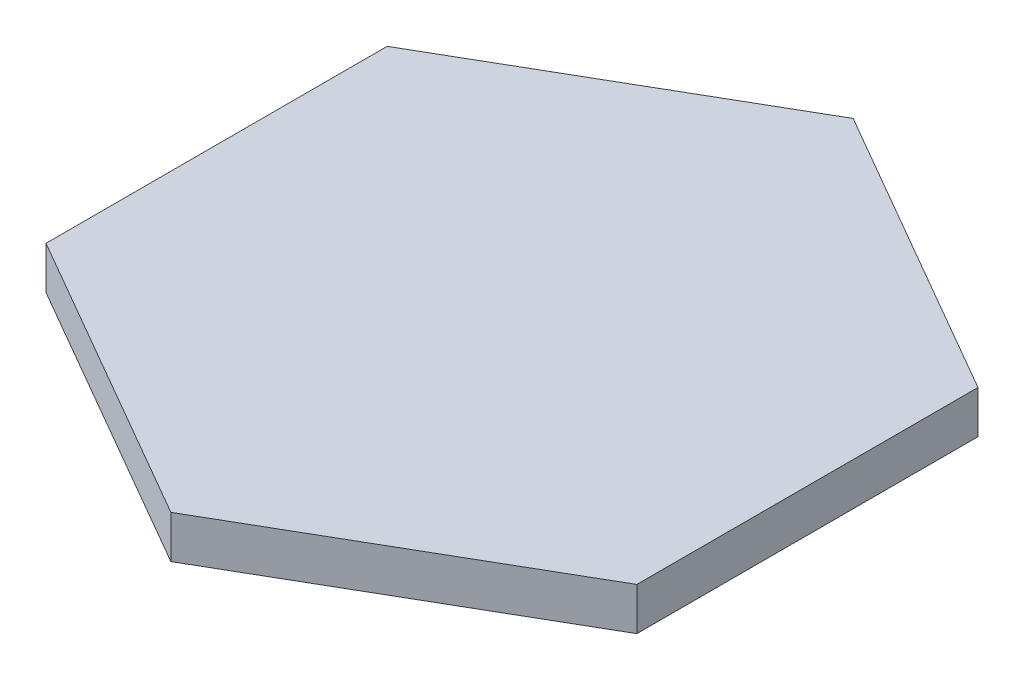
from build123d import *

# Parameters (mm, degrees)
BOSS_EXTRUDE1_DEPTH = 6.35


with BuildPart() as part:
    # Sketch1 → Boss-Extrude1 (new body)
    with BuildSketch(Plane(origin=(0, 0, 0), x_dir=(1, 0, 0), z_dir=(0, 1, 0))):
        Polygon((43.994090512, 25.4), (0, 50.8), (-43.994090512, 25.4), (-43.994090512, -25.4), (0, -50.8), (43.994090512, -25.4), align=None)
    extrude(amount=-BOSS_EXTRUDE1_DEPTH)


solid = part.part
